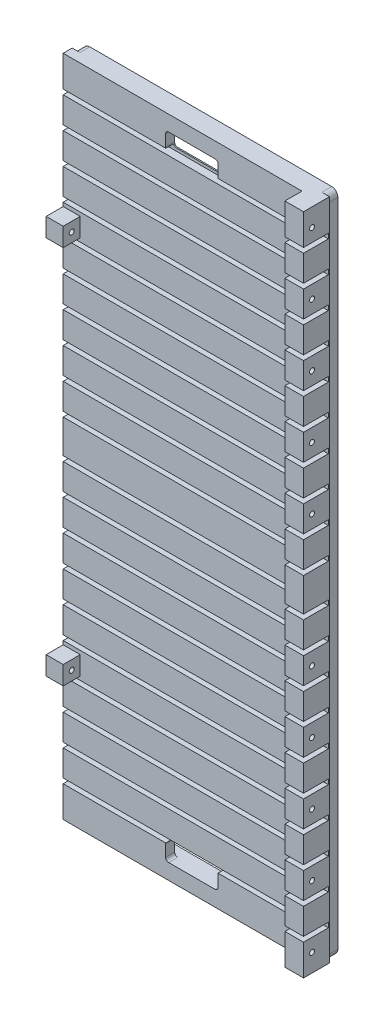
from build123d import *

# Parameters (mm, degrees)
SKETCH1_W                 = 83
SKETCH1_H                 = 214
BOSS_EXTRUDE1_DEPTH       = 8.4
SKETCH2_W                 = 77
SKETCH2_H                 = 5.5
CUT_EXTRUDE1_DEPTH        = 219.148596145
SKETCH3_W                 = 8
SKETCH3_H                 = 1.6
CUT_EXTRUDE2_DEPTH        = 136.678148572
LPATTERN1_COUNT           = 10
LPATTERN1_PITCH           = 10
MIRROR1_COPY_1_SKETCH_W   = 8
MIRROR1_COPY_1_SKETCH_H   = 1.6
MIRROR1_COPY_1_DEPTH      = 136.678148572
MIRROR1_COPY_2_SKETCH_W   = 8
MIRROR1_COPY_2_SKETCH_H   = 1.6
MIRROR1_COPY_2_DEPTH      = 136.678148572
MIRROR1_COPY_3_SKETCH_W   = 8
MIRROR1_COPY_3_SKETCH_H   = 1.6
MIRROR1_COPY_3_DEPTH      = 136.678148572
MIRROR1_COPY_4_SKETCH_W   = 8
MIRROR1_COPY_4_SKETCH_H   = 1.6
MIRROR1_COPY_4_DEPTH      = 136.678148572
MIRROR1_COPY_5_SKETCH_W   = 8
MIRROR1_COPY_5_SKETCH_H   = 1.6
MIRROR1_COPY_5_DEPTH      = 136.678148572
MIRROR1_COPY_6_SKETCH_W   = 8
MIRROR1_COPY_6_SKETCH_H   = 1.6
MIRROR1_COPY_6_DEPTH      = 136.678148572
MIRROR1_COPY_7_SKETCH_W   = 8
MIRROR1_COPY_7_SKETCH_H   = 1.6
MIRROR1_COPY_7_DEPTH      = 136.678148572
MIRROR1_COPY_8_SKETCH_W   = 8
MIRROR1_COPY_8_SKETCH_H   = 1.6
MIRROR1_COPY_8_DEPTH      = 136.678148572
MIRROR1_COPY_9_SKETCH_W   = 8
MIRROR1_COPY_9_SKETCH_H   = 1.6
MIRROR1_COPY_9_DEPTH      = 136.678148572
BOSS_EXTRUDE2_DEPTH       = 3.18
SKETCH5_W                 = 5.5
SKETCH5_H                 = 6
BOSS_EXTRUDE3_DEPTH       = 5.5
CUT_EXTRUDE3_DEPTH        = 116.073063746
M2X0_4_TAPPED_HOLE1_D     = 1.6
M2X0_4_TAPPED_HOLE2_D     = 1.6
M2X0_4_TAPPED_HOLE2_DEPTH = 4
M2X0_4_TAPPED_HOLE2_TIP   = 0.480688495


with BuildPart() as part:
    # Sketch1 → Boss-Extrude1 (new body)
    with BuildSketch(Plane.XY):
        Rectangle(SKETCH1_W, SKETCH1_H)
    extrude(amount=BOSS_EXTRUDE1_DEPTH)

    # Sketch2 → Cut-Extrude1 (cut, through all)
    with BuildSketch(Plane(origin=(0, 107, 0), x_dir=(1, 0, 0), z_dir=(0, 1, 0))):
        with Locations((-3, -5.65)):
            Rectangle(SKETCH2_W, SKETCH2_H)
    extrude(amount=-CUT_EXTRUDE1_DEPTH, mode=Mode.SUBTRACT)

    # Sketch3 → Cut-Extrude2 (cut, through all)
    with BuildSketch(Plane(origin=(41.5, 0, 0), x_dir=(0, 0, -1), z_dir=(1, 0, 0))):
        with Locations((-4.4, 96.2)):
            Rectangle(SKETCH3_W, SKETCH3_H)
    cut_extrude2 = extrude(amount=-CUT_EXTRUDE2_DEPTH, mode=Mode.SUBTRACT)

    # LPattern1: Cut-Extrude2 ×10
    with Locations(*[(0, -i * LPATTERN1_PITCH, 0) for i in range(1, LPATTERN1_COUNT)]):
        add(cut_extrude2, mode=Mode.SUBTRACT)

    # Mirror1: Cut-Extrude2 across plane
    add(cut_extrude2.mirror(Plane.ZX), mode=Mode.SUBTRACT)

    # Mirror1 copy 1 sketch → Mirror1 copy 1 (cut, through all)
    with BuildSketch(Plane(origin=(41.5, 10, 0), x_dir=(0, 0, -1), z_dir=(1, 0, 0))):
        with Locations((-4.4, -96.2)):
            Rectangle(MIRROR1_COPY_1_SKETCH_W, MIRROR1_COPY_1_SKETCH_H)
    extrude(amount=-MIRROR1_COPY_1_DEPTH, mode=Mode.SUBTRACT)

    # Mirror1 copy 2 sketch → Mirror1 copy 2 (cut, through all)
    with BuildSketch(Plane(origin=(41.5, 20, 0), x_dir=(0, 0, -1), z_dir=(1, 0, 0))):
        with Locations((-4.4, -96.2)):
            Rectangle(MIRROR1_COPY_2_SKETCH_W, MIRROR1_COPY_2_SKETCH_H)
    extrude(amount=-MIRROR1_COPY_2_DEPTH, mode=Mode.SUBTRACT)

    # Mirror1 copy 3 sketch → Mirror1 copy 3 (cut, through all)
    with BuildSketch(Plane(origin=(41.5, 30, 0), x_dir=(0, 0, -1), z_dir=(1, 0, 0))):
        with Locations((-4.4, -96.2)):
            Rectangle(MIRROR1_COPY_3_SKETCH_W, MIRROR1_COPY_3_SKETCH_H)
    extrude(amount=-MIRROR1_COPY_3_DEPTH, mode=Mode.SUBTRACT)

    # Mirror1 copy 4 sketch → Mirror1 copy 4 (cut, through all)
    with BuildSketch(Plane(origin=(41.5, 40, 0), x_dir=(0, 0, -1), z_dir=(1, 0, 0))):
        with Locations((-4.4, -96.2)):
            Rectangle(MIRROR1_COPY_4_SKETCH_W, MIRROR1_COPY_4_SKETCH_H)
    extrude(amount=-MIRROR1_COPY_4_DEPTH, mode=Mode.SUBTRACT)

    # Mirror1 copy 5 sketch → Mirror1 copy 5 (cut, through all)
    with BuildSketch(Plane(origin=(41.5, 50, 0), x_dir=(0, 0, -1), z_dir=(1, 0, 0))):
        with Locations((-4.4, -96.2)):
            Rectangle(MIRROR1_COPY_5_SKETCH_W, MIRROR1_COPY_5_SKETCH_H)
    extrude(amount=-MIRROR1_COPY_5_DEPTH, mode=Mode.SUBTRACT)

    # Mirror1 copy 6 sketch → Mirror1 copy 6 (cut, through all)
    with BuildSketch(Plane(origin=(41.5, 60, 0), x_dir=(0, 0, -1), z_dir=(1, 0, 0))):
        with Locations((-4.4, -96.2)):
            Rectangle(MIRROR1_COPY_6_SKETCH_W, MIRROR1_COPY_6_SKETCH_H)
    extrude(amount=-MIRROR1_COPY_6_DEPTH, mode=Mode.SUBTRACT)

    # Mirror1 copy 7 sketch → Mirror1 copy 7 (cut, through all)
    with BuildSketch(Plane(origin=(41.5, 70, 0), x_dir=(0, 0, -1), z_dir=(1, 0, 0))):
        with Locations((-4.4, -96.2)):
            Rectangle(MIRROR1_COPY_7_SKETCH_W, MIRROR1_COPY_7_SKETCH_H)
    extrude(amount=-MIRROR1_COPY_7_DEPTH, mode=Mode.SUBTRACT)

    # Mirror1 copy 8 sketch → Mirror1 copy 8 (cut, through all)
    with BuildSketch(Plane(origin=(41.5, 80, 0), x_dir=(0, 0, -1), z_dir=(1, 0, 0))):
        with Locations((-4.4, -96.2)):
            Rectangle(MIRROR1_COPY_8_SKETCH_W, MIRROR1_COPY_8_SKETCH_H)
    extrude(amount=-MIRROR1_COPY_8_DEPTH, mode=Mode.SUBTRACT)

    # Mirror1 copy 9 sketch → Mirror1 copy 9 (cut, through all)
    with BuildSketch(Plane(origin=(41.5, 90, 0), x_dir=(0, 0, -1), z_dir=(1, 0, 0))):
        with Locations((-4.4, -96.2)):
            Rectangle(MIRROR1_COPY_9_SKETCH_W, MIRROR1_COPY_9_SKETCH_H)
    extrude(amount=-MIRROR1_COPY_9_DEPTH, mode=Mode.SUBTRACT)

    # Sketch4 → Boss-Extrude2 (add)
    with BuildSketch(Plane(origin=(0, 0, 0), x_dir=(-1, 0, 0), z_dir=(0, 0, -1))):
        with BuildLine():
            Line((-39, 107), (39, 107))
            ThreePointArc((39, 107), (40.414213562, 106.414213562), (41, 105))
            Line((41, 105), (41, -105))
            ThreePointArc((41, -105), (40.414213562, -106.414213562), (39, -107))
            Line((39, -107), (-39, -107))
            ThreePointArc((-39, -107), (-40.414213562, -106.414213562), (-41, -105))
            Line((-41, -105), (-41, 105))
            ThreePointArc((-41, 105), (-40.414213562, 106.414213562), (-39, 107))
        make_face()
        with BuildLine():
            Line((-33.5, -102), (33.5, -102))
            ThreePointArc((33.5, -102), (34.914213562, -101.414213562), (35.5, -100))
            Line((35.5, -100), (35.5, 100))
            ThreePointArc((35.5, 100), (34.914213562, 101.414213562), (33.5, 102))
            Line((33.5, 102), (-33.5, 102))
            ThreePointArc((-33.5, 102), (-34.914213562, 101.414213562), (-35.5, 100))
            Line((-35.5, 100), (-35.5, -100))
            ThreePointArc((-35.5, -100), (-34.914213562, -101.414213562), (-33.5, -102))
        make_face(mode=Mode.SUBTRACT)
    extrude(amount=BOSS_EXTRUDE2_DEPTH)

    # Sketch5 → Boss-Extrude3 (add)
    with BuildSketch(Plane.XY.offset(2.9)):
        with Locations((-38.75, 61.2)):
            Rectangle(SKETCH5_W, SKETCH5_H)
    boss_extrude3 = extrude(amount=BOSS_EXTRUDE3_DEPTH)

    # Mirror2: Boss-Extrude3 across plane
    add(boss_extrude3.mirror(Plane.ZX))

    # Sketch6 → Cut-Extrude3 (cut, through all)
    with BuildSketch(Plane(origin=(0, 0, 0), x_dir=(-1, 0, 0), z_dir=(0, 0, -1))):
        with BuildLine():
            Line((-7.475, 96.3), (7.475, 96.3))
            ThreePointArc((7.475, 96.3), (8.182106781, 96.592893219), (8.475, 97.3))
            Line((8.475, 97.3), (8.475, 101))
            ThreePointArc((8.475, 101), (8.182106781, 101.707106781), (7.475, 102))
            Line((7.475, 102), (-7.475, 102))
            ThreePointArc((-7.475, 102), (-8.182106781, 101.707106781), (-8.475, 101))
            Line((-8.475, 101), (-8.475, 97.3))
            ThreePointArc((-8.475, 97.3), (-8.182106781, 96.592893219), (-7.475, 96.3))
        make_face()
    cut_extrude3 = extrude(amount=-CUT_EXTRUDE3_DEPTH, mode=Mode.SUBTRACT)

    # Mirror3: Cut-Extrude3 across plane
    add(cut_extrude3.mirror(Plane.ZX), mode=Mode.SUBTRACT)

    # M2x0.4 Tapped Hole1 (through all)
    with Locations(Plane(origin=(41.5, 0, 0), x_dir=(0, 0, -1), z_dir=(1, 0, 0))):
        with Locations((-5.65, 101.2), (-5.65, 81.2), (-5.65, 61.2), (-5.65, 41.2), (-5.65, 21.2), (-5.65, -101.2), (-5.65, -81.2), (-5.65, -61.2), (-5.65, -41.2), (-5.65, -21.2)):
            Hole(M2X0_4_TAPPED_HOLE1_D / 2)

    # M2x0.4 Tapped Hole2
    with Locations(Plane(origin=(0, 0, -3.18), x_dir=(-1, 0, 0), z_dir=(0, 0, -1))):
        with Locations((-37.5, 101.2), (37.5, 101.2), (37.5, 81.2), (37.5, 61.2), (37.5, 41.2), (37.5, 21.2), (-37.5, 81.2), (-37.5, 61.2), (-37.5, 41.2), (-37.5, 21.2), (37.5, -101.2), (-37.5, -21.2), (-37.5, -41.2), (-37.5, -61.2), (-37.5, -81.2), (37.5, -21.2), (37.5, -41.2), (37.5, -61.2), (37.5, -81.2), (-37.5, -101.2)):
            Hole(M2X0_4_TAPPED_HOLE2_D / 2, depth=M2X0_4_TAPPED_HOLE2_DEPTH)
            with Locations((0, 0, -(M2X0_4_TAPPED_HOLE2_DEPTH + M2X0_4_TAPPED_HOLE2_TIP / 2))):  # 118° drill point
                Cone(0, M2X0_4_TAPPED_HOLE2_D / 2, M2X0_4_TAPPED_HOLE2_TIP, mode=Mode.SUBTRACT)


solid = part.part
